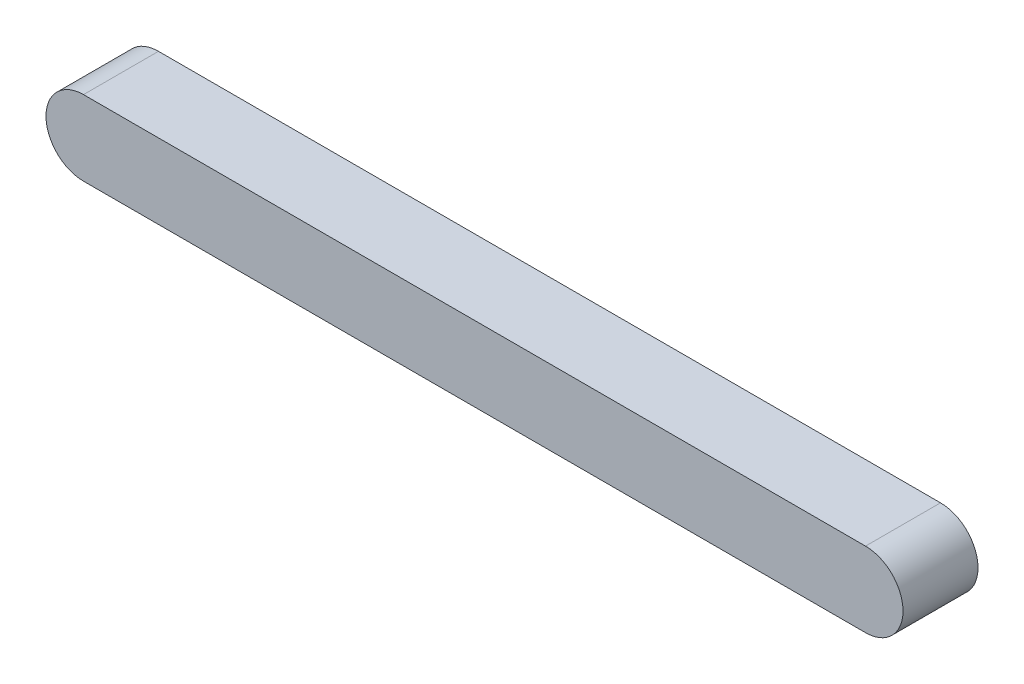
from build123d import *

# Parameters (mm, degrees)
Y_KSEKLIK_EKSTR_ZYON1_DEPTH = 7


with BuildPart() as part:
    # Çizim1 → Yükseklik-Ekstrüzyon1 (new body)
    with BuildSketch(Plane.XY):
        with BuildLine():
            Line((-36.5, 3.5), (36.5, 3.5))
            ThreePointArc((36.5, 3.5), (40, 0), (36.5, -3.5))
            Line((36.5, -3.5), (-36.5, -3.5))
            ThreePointArc((-36.5, -3.5), (-40, 0), (-36.5, 3.5))
        make_face()
    extrude(amount=Y_KSEKLIK_EKSTR_ZYON1_DEPTH)


solid = part.part
